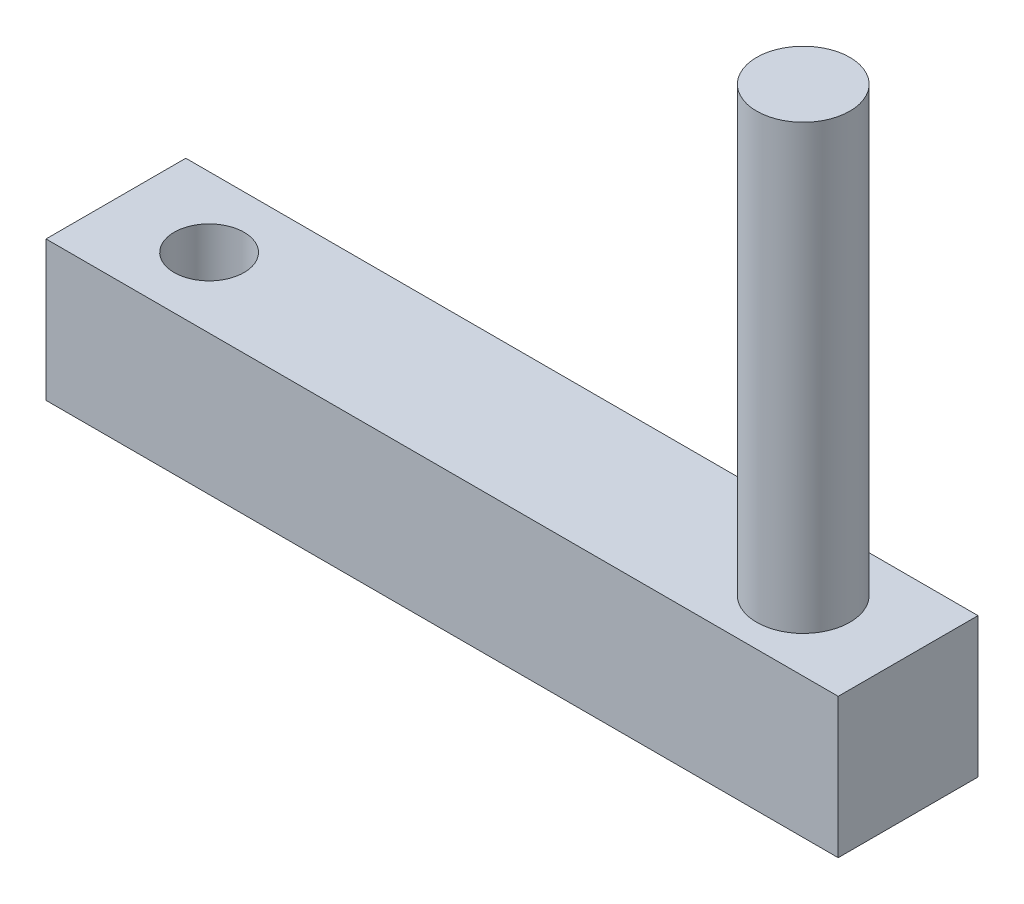
from build123d import *

# Parameters (mm, degrees)
CROQUIS1_W              = 17
CROQUIS1_H              = 3
CROQUIS1_R              = 0.75
SALIENTE_EXTRUIR1_DEPTH = 3
CROQUIS2_R              = 1
SALIENTE_EXTRUIR2_DEPTH = 9.5


with BuildPart() as part:
    # Croquis1 → Saliente-Extruir1 (new body)
    with BuildSketch(Plane(origin=(0, 0, 0), x_dir=(1, 0, 0), z_dir=(0, 1, 0))):
        Rectangle(CROQUIS1_W, CROQUIS1_H)
        with Locations(Location((-6.5, 0, 0), (0, 0, 270))):
            Circle(CROQUIS1_R, mode=Mode.SUBTRACT)
    extrude(amount=SALIENTE_EXTRUIR1_DEPTH)

    # Croquis2 → Saliente-Extruir2 (add)
    with BuildSketch(Plane(origin=(0, 3, 0), x_dir=(1, 0, 0), z_dir=(0, 1, 0))):
        with Locations(Location((6.25, 0, 0), (0, 0, 90))):
            Circle(CROQUIS2_R)
    extrude(amount=SALIENTE_EXTRUIR2_DEPTH)


solid = part.part
